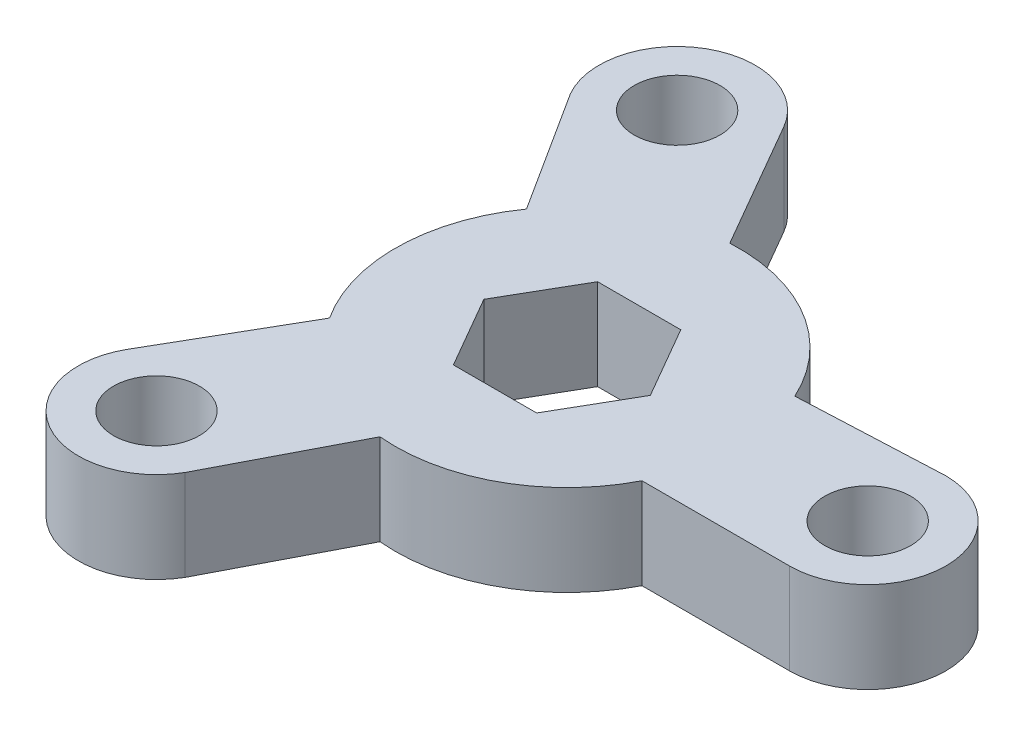
from build123d import *

# Parameters (mm, degrees)
SKETCH1_R           = 1.5
BOSS_EXTRUDE1_DEPTH = 3.175
CUT_EXTRUDE1_DEPTH  = 10


with BuildPart() as part:
    # Sketch1 → Boss-Extrude1 (new body)
    with BuildSketch(Plane(origin=(0, 0, 0), x_dir=(1, 0, 0), z_dir=(0, 1, 0))):
        with BuildLine():
            Line((7.858300919, -2.484134681), (13.014762042, -2.484134681))
            ThreePointArc((13.014762042, -2.484134681), (15.743606535, 0.244709812), (13.014762042, 2.973554305))
            Line((13.014762042, 2.973554305), (7.969118099, 2.744709812))
            ThreePointArc((7.969118099, 2.744709812), (5.624188125, 5.376129638), (2.206241257, 6.236772472))
            Line((2.206241257, 6.236772472), (-0.371989304, 10.702398798))
            ThreePointArc((-0.371989304, 10.702398798), (-4.099660205, 11.701225206), (-5.098486612, 7.973554305))
            Line((-5.098486612, 7.973554305), (-2.377479496, 3.718320719))
            ThreePointArc((-2.377479496, 3.718320719), (-3.483890927, 0.371841879), (-2.520256051, -3.018508355))
            Line((-2.520256051, -3.018508355), (-5.098486612, -7.484134681))
            ThreePointArc((-5.098486612, -7.484134681), (-4.099660205, -11.211805582), (-0.371989304, -10.212979174))
            Line((-0.371989304, -10.212979174), (1.952647522, -5.728901095))
            ThreePointArc((1.952647522, -5.728901095), (5.403988927, -5.013842081), (7.858300919, -2.484134681))
        make_face()
        Polygon((3.965354593, 2.757209812), (5.415947144, 0.244709812), (3.965354593, -2.267790188), (1.06416949, -2.267790188), (-0.386423061, 0.244709812), (1.06416949, 2.757209812), align=None, mode=Mode.SUBTRACT)
        with Locations(Location((13.014762042, 0.244709812, 0), (0, 0, 270))):
            Circle(SKETCH1_R, mode=Mode.SUBTRACT)
        with Locations(Location((-2.735237958, 9.337976552, 0), (0, 0, 270))):
            Circle(SKETCH1_R, mode=Mode.SUBTRACT)
        with Locations(Location((-2.735237958, -8.848556928, 0), (0, 0, 270))):
            Circle(SKETCH1_R, mode=Mode.SUBTRACT)
    extrude(amount=BOSS_EXTRUDE1_DEPTH)

    # Sketch2 → Cut-Extrude1 (cut)
    with BuildSketch(Plane(origin=(0, 3.175, 0), x_dir=(1, 0, 0), z_dir=(0, 1, 0))):
        Polygon((5.421720647, 0.244709812), (3.968241344, 2.762209812), (1.061282739, 2.762209812), (-0.392196564, 0.244709812), (1.061282739, -2.272790188), (3.968241344, -2.272790188), align=None)
    extrude(amount=-CUT_EXTRUDE1_DEPTH, mode=Mode.SUBTRACT)


solid = part.part
